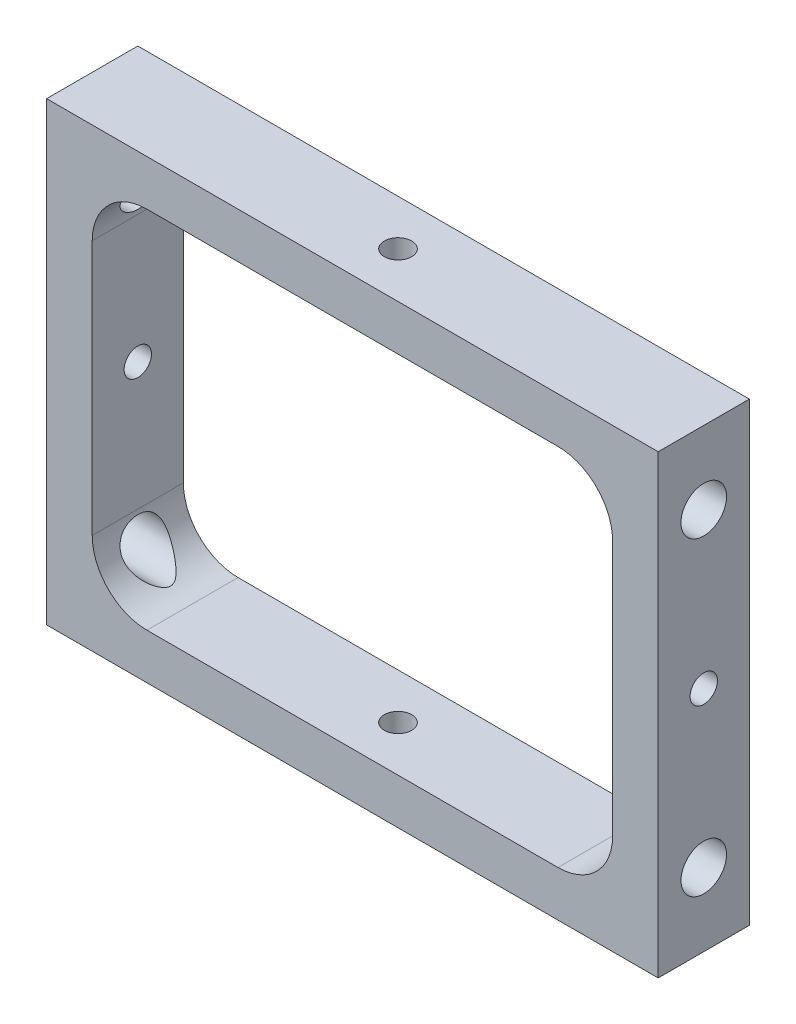
from build123d import *

# Parameters (mm, degrees)
SKETCH_1_W          = 67.09
SKETCH_1_H          = 50
EXTRUDE_1_DEPTH     = 10
SKETCH_2_R          = 2.5
SKETCH_2_R_2        = 1.5
CUT_EXTRUDE_1_DEPTH = 85.267835501
SKETCH_3_R          = 1.5
CUT_EXTRUDE_2_DEPTH = 85.267835592


with BuildPart() as part:
    # 草图1 → 凸台-拉伸1 (new body)
    with BuildSketch(Plane.XY):
        with Locations((33.545, 25)):
            Rectangle(SKETCH_1_W, SKETCH_1_H)
        with BuildLine():
            Line((11, 45), (56.09, 45))
            ThreePointArc((56.09, 45), (60.332640687, 43.242640687), (62.09, 39))
            Line((62.09, 39), (62.09, 11))
            ThreePointArc((62.09, 11), (60.332640687, 6.757359313), (56.09, 5))
            Line((56.09, 5), (11, 5))
            ThreePointArc((11, 5), (6.757359313, 6.757359313), (5, 11))
            Line((5, 11), (5, 39))
            ThreePointArc((5, 39), (6.757359313, 43.242640687), (11, 45))
        make_face(mode=Mode.SUBTRACT)
    extrude(amount=EXTRUDE_1_DEPTH)

    # 草图2 → 切除-拉伸1 (cut, through all)
    with BuildSketch(Plane.ZY):
        with Locations((5, 42)):
            Circle(SKETCH_2_R)
        with Locations((5, 8)):
            Circle(SKETCH_2_R)
        with Locations((5, 25)):
            Circle(SKETCH_2_R_2)
    extrude(amount=-CUT_EXTRUDE_1_DEPTH, mode=Mode.SUBTRACT)

    # 草图3 → 切除-拉伸2 (cut, through all)
    with BuildSketch(Plane.XZ):
        with Locations(Location((33.545, 5, 0), (0, 0, 270))):
            Circle(SKETCH_3_R)
    extrude(amount=-CUT_EXTRUDE_2_DEPTH, mode=Mode.SUBTRACT)


solid = part.part
